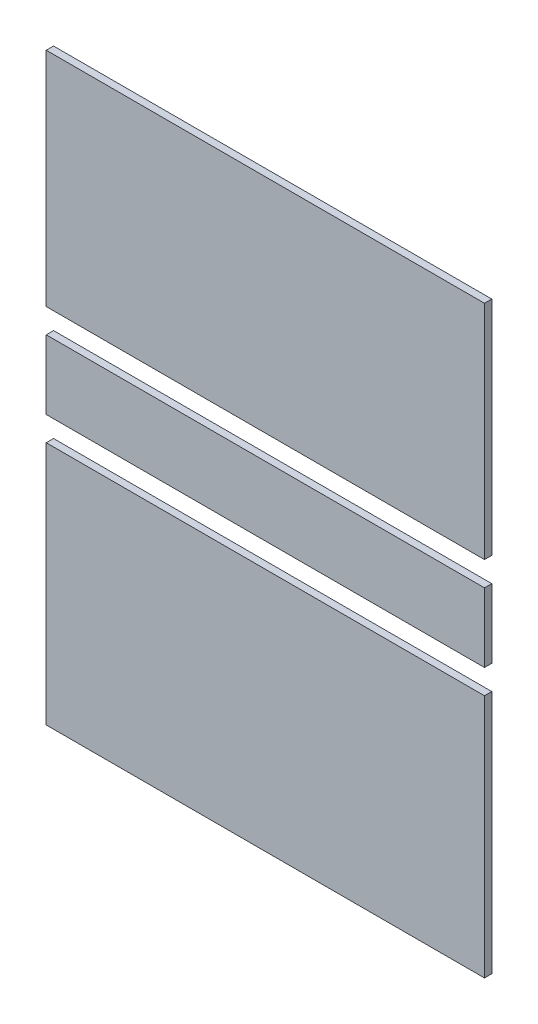
from build123d import *

# Parameters (mm, degrees)
SKETCH1_W             = 304.8
SKETCH1_H             = 154.4
BOSS_EXTRUDE1_DEPTH   = 5.08
SKETCH1_H_2           = 170
BOSS_EXTRUDE1_2_DEPTH = 5.08
SKETCH2_W             = 304.8
SKETCH2_H             = 48
BOSS_EXTRUDE2_DEPTH   = 5.08


with BuildPart() as part:
    # Sketch1 → Boss-Extrude1 (new body)
    with BuildSketch(Plane.XY):
        with Locations((152.4, 329.2)):
            Rectangle(SKETCH1_W, SKETCH1_H)
    extrude(amount=BOSS_EXTRUDE1_DEPTH)


with BuildPart() as body_2:
    # Sketch1 → Boss-Extrude1 2 (new body)
    with BuildSketch(Plane.XY):
        with Locations((152.4, 85)):
            Rectangle(SKETCH1_W, SKETCH1_H_2)
    extrude(amount=BOSS_EXTRUDE1_2_DEPTH)


with BuildPart() as body_3:
    # Sketch2 → Boss-Extrude2 (new body)
    with BuildSketch(Plane.XY.offset(5.08)):
        with Locations((152.4, 211)):
            Rectangle(SKETCH2_W, SKETCH2_H)
    extrude(amount=-BOSS_EXTRUDE2_DEPTH)


solid = Compound([part.part, body_2.part, body_3.part])
